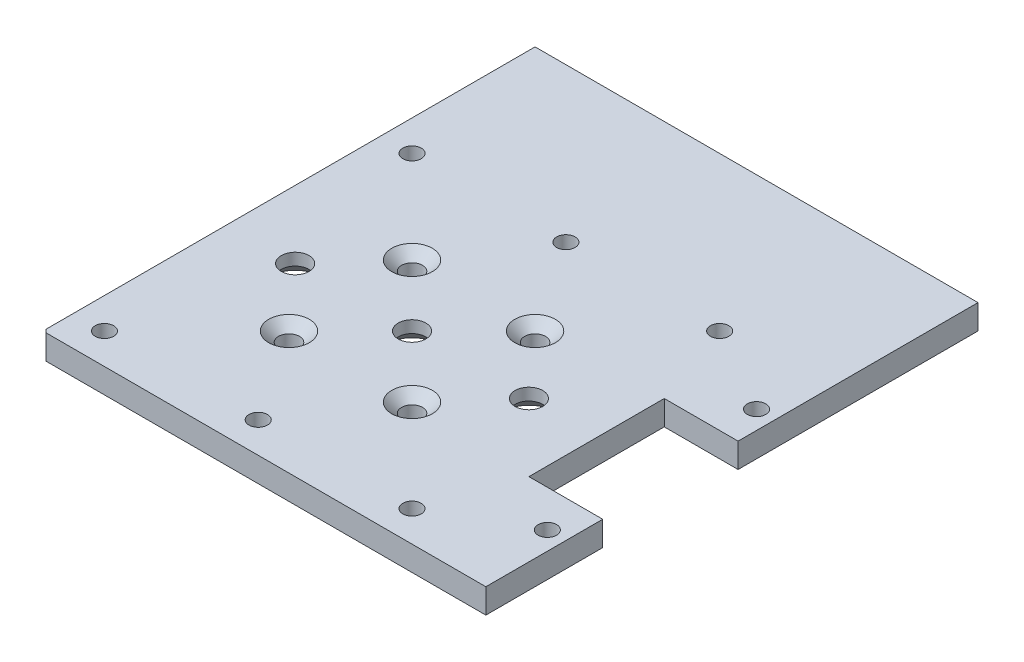
from build123d import *

# Parameters (mm, degrees)
SKETCH_1_W                   = 60
SKETCH_1_H                   = 60
EXTRUDE_1_DEPTH              = 4
HOLE_WIZARD_M3_1_D           = 3.4
HOLE_WIZARD_M3_1_CSINK_D     = 6.6
HOLE_WIZARD_M3_1_CSINK_ANGLE = 90
HOLE_WIZARD_M4_1_AT_2_COUNT  = 2
HOLE_WIZARD_M4_1_AT_2_PITCH  = 19
HOLE_WIZARD_M4_1_AT_3_COUNT  = 2
HOLE_WIZARD_M4_1_AT_3_PITCH  = 38
HOLE_WIZARD_1_D              = 3
SKETCH_9_W                   = 12
SKETCH_9_H                   = 19
SKETCH_9_R                   = 1.5
EXTRUDE_3_DEPTH              = 4
CHAMFER_1_SIZE               = 0.5
SKETCH_10_W                  = 72
SKETCH_10_H                  = 4
EXTRUDE_4_DEPTH              = 20


with BuildPart() as part:
    # 草图1 → 凸台-拉伸1 (new body)
    with BuildSketch(Plane(origin=(0, 0, 0), x_dir=(1, 0, 0), z_dir=(0, 1, 0))):
        Rectangle(SKETCH_1_W, SKETCH_1_H)
    extrude(amount=EXTRUDE_1_DEPTH)

    # M3 十字槽沉头木螺钉的锥形沉头孔1 (through all)
    with Locations(Plane(origin=(0, 4, 0), x_dir=(1, 0, 0), z_dir=(0, 1, 0))):
        with Locations((-10, 10), (10, 10), (10, -10), (-10, -10)):
            CounterSinkHole(HOLE_WIZARD_M3_1_D / 2, HOLE_WIZARD_M3_1_CSINK_D / 2, counter_sink_angle=HOLE_WIZARD_M3_1_CSINK_ANGLE)

    # 草图5 → M4 十字槽沉头木螺钉的锥形沉头孔1 (revolve, cut)
    with BuildSketch(Plane(origin=(-19, 0, 0), x_dir=(0, 0, -1), z_dir=(1, 0, 0))):
        Polygon((0, 0), (0, 4), (2.25, 4), (2.25, 2.05), (4.3, 0), align=None)
    hole_wizard_m4_1 = revolve(axis=Axis((-19, -6.35, 0), (0, 1, 0)), mode=Mode.SUBTRACT)

    # M4 十字槽沉头木螺钉的锥形沉头孔1 at 2: M4 十字槽沉头木螺钉的锥形沉头孔1 ×2
    with Locations(*[(i * HOLE_WIZARD_M4_1_AT_2_PITCH, 0, 0) for i in range(1, HOLE_WIZARD_M4_1_AT_2_COUNT)]):
        add(hole_wizard_m4_1, mode=Mode.SUBTRACT)

    # M4 十字槽沉头木螺钉的锥形沉头孔1 at 3: M4 十字槽沉头木螺钉的锥形沉头孔1 ×2
    with Locations(*[(i * HOLE_WIZARD_M4_1_AT_3_PITCH, 0, 0) for i in range(1, HOLE_WIZARD_M4_1_AT_3_COUNT)]):
        add(hole_wizard_m4_1, mode=Mode.SUBTRACT)

    # 孔1 (through all)
    with Locations(Plane(origin=(0, 4, 0), x_dir=(1, 0, 0), z_dir=(0, 1, 0))):
        with Locations((25, 25), (25, -25), (0, -25), (-25, -25), (-25, 25), (0, 25)):
            Hole(HOLE_WIZARD_1_D / 2)

    # 草图9 → 凸台-拉伸3 (add)
    with BuildSketch(Plane(origin=(0, 4, 0), x_dir=(1, 0, 0), z_dir=(0, 1, 0))):
        with Locations((36, -20.5)):
            Rectangle(SKETCH_9_W, SKETCH_9_H)
        with Locations(Location((39, -17, 0), (0, 0, 270))):
            Circle(SKETCH_9_R, mode=Mode.SUBTRACT)
    extrude_3 = extrude(amount=-EXTRUDE_3_DEPTH)

    # 倒角1
    chamfer_1_edges = [part.edges().sort_by_distance(p)[0] for p in [
        (-30, 2, 30),
    ]]
    chamfer(chamfer_1_edges, length=CHAMFER_1_SIZE)

    # 镜向1: 凸台-拉伸3 across plane
    add(extrude_3.mirror(Plane.XY))

    # 草图10 → 凸台-拉伸4 (add)
    with BuildSketch(Plane(origin=(0, 0, -30), x_dir=(-1, 0, 0), z_dir=(0, 0, -1))):
        with Locations((-6, 2)):
            Rectangle(SKETCH_10_W, SKETCH_10_H)
    extrude(amount=EXTRUDE_4_DEPTH)


solid = part.part
